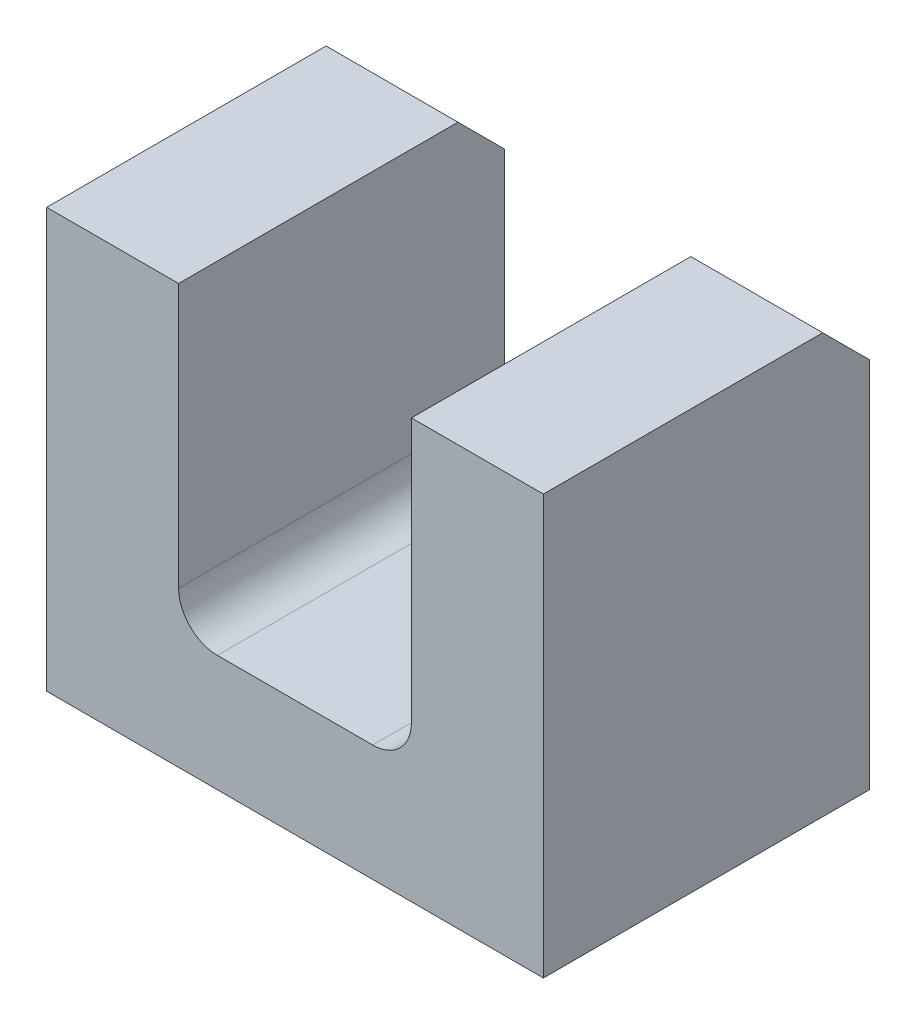
from build123d import *

# Parameters (mm, degrees)
SKETCH1_W           = 6.4
SKETCH1_H           = 4.2
BOSS_EXTRUDE1_DEPTH = 5.4
SKETCH2_W           = 3
SKETCH2_H           = 4.2
CUT_EXTRUDE1_DEPTH  = 3.9
FILLET1_R           = 0.5
CHAMFER1_SIZE       = 0.6


with BuildPart() as part:
    # Sketch1 → Boss-Extrude1 (new body)
    with BuildSketch(Plane(origin=(0, 0, 0), x_dir=(1, 0, 0), z_dir=(0, 1, 0))):
        Rectangle(SKETCH1_W, SKETCH1_H)
    extrude(amount=BOSS_EXTRUDE1_DEPTH)

    # Sketch2 → Cut-Extrude1 (cut)
    with BuildSketch(Plane(origin=(0, 5.4, 0), x_dir=(1, 0, 0), z_dir=(0, 1, 0))):
        Rectangle(SKETCH2_W, SKETCH2_H)
    extrude(amount=-CUT_EXTRUDE1_DEPTH, mode=Mode.SUBTRACT)

    # Fillet1
    fillet1_edges = [part.edges().sort_by_distance(p)[0] for p in [
        (-1.5, 1.5, 0),
        (1.5, 1.5, 0),
    ]]
    fillet(fillet1_edges, radius=FILLET1_R)

    # Chamfer1
    chamfer1_edges = [part.edges().sort_by_distance(p)[0] for p in [
        (2.35, 5.4, -2.1),
        (-2.35, 5.4, -2.1),
    ]]
    chamfer(chamfer1_edges, length=CHAMFER1_SIZE)


solid = part.part
